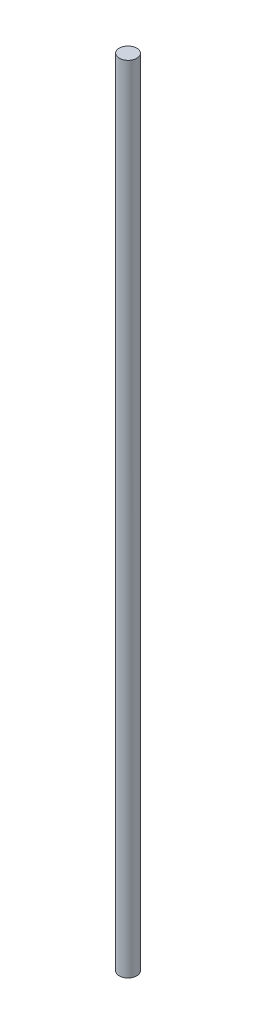
from build123d import *

# Parameters (mm, degrees)
ESQUISSE1_R        = 4
BOSS_EXTRU_1_DEPTH = 362


with BuildPart() as part:
    # Esquisse1 → Boss.-Extru.1 (new body)
    with BuildSketch(Plane(origin=(0, 0, 0), x_dir=(1, 0, 0), z_dir=(0, 1, 0))):
        with Locations(Location((0, 0, 0), (0, 0, 90))):
            Circle(ESQUISSE1_R)
    extrude(amount=BOSS_EXTRU_1_DEPTH)


solid = part.part
